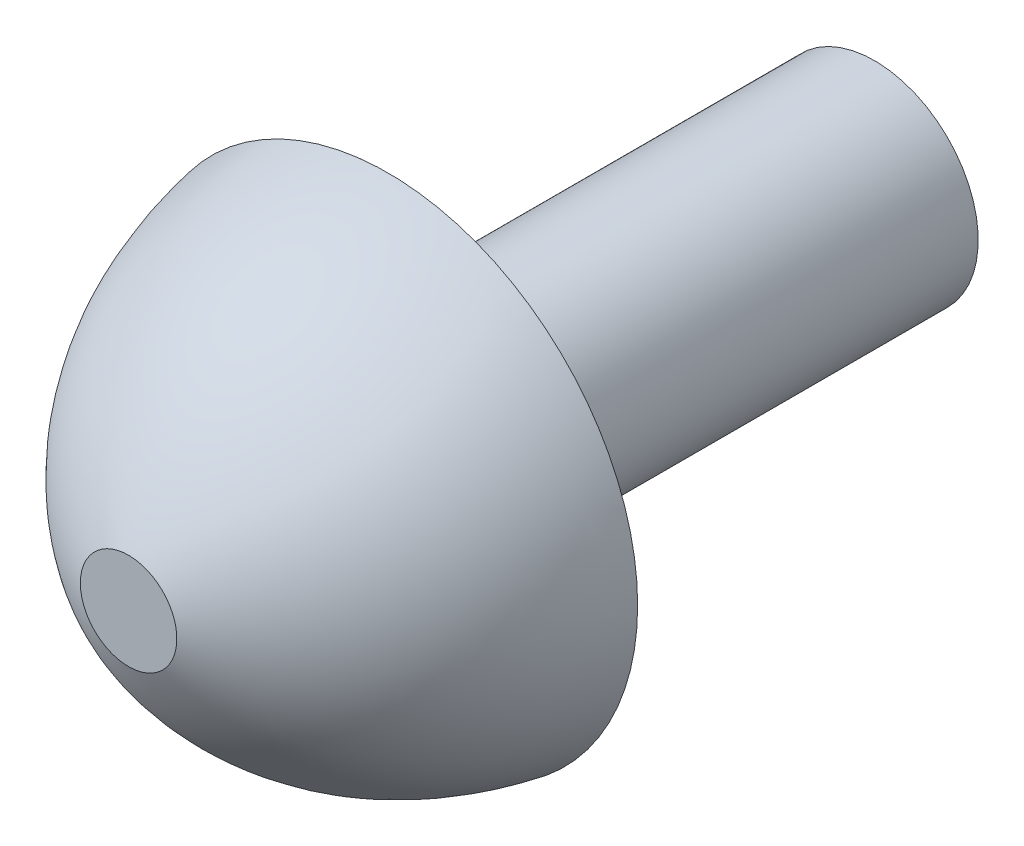
from build123d import *


with BuildPart() as part:
    # 草图1 → 旋转2 (revolve)
    with BuildSketch(Plane(origin=(0, 0, 0), x_dir=(1, 0, 0), z_dir=(0, 1, 0)), mode=Mode.PRIVATE) as revolve_2_sk:
        Polygon((-4.338716718, -3.803797468), (-4.142514186, -3.803797468), (-1.142514186, -3.803797468), (-1.142514186, 11.196202532), (-4.338716718, 11.196202532), align=None)
        with BuildLine():
            Line((-1.142514186, -3.803797468), (-4.142514186, -3.803797468))
            Line((-4.142514186, -3.803797468), (-4.338716718, -3.803797468))
            Line((-4.338716718, -3.803797468), (-4.338716718, -11.803797468))
            Line((-4.338716718, -11.803797468), (-2.851374945, -11.803797468))
            add(Edge.make_bspline(
                [(3.357485814, -3.803797468), (2.343965818, -9.418864618), (-2.851374945, -11.803797468)],
                knots=[0, 0, 0, 1, 1, 1], degree=2))
            Line((3.357485814, -3.803797468), (-1.142514186, -3.803797468))
        make_face()
    revolve(revolve_2_sk.sketch.rotate(Axis((-4.338716718, 0, -16.297468354), (0, 0, 1)), 180), axis=Axis((-4.338716718, 0, -16.297468354), (0, 0, 1)))


solid = part.part
